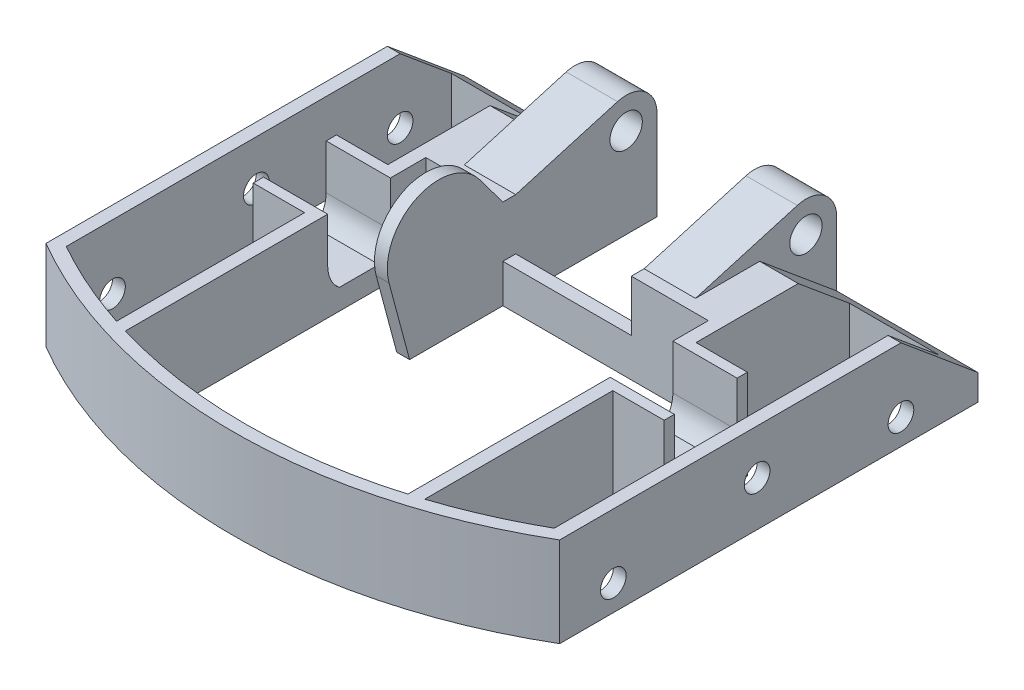
from build123d import *

# Parameters (mm, degrees)
BOSS_EXTRUDE1_DEPTH     = 22.225
CUT_EXTRUDE3_DEPTH      = 155.828053821
CUT_EXTRUDE3_DEPTH_BACK = 155.828053821
BOSS_EXTRUDE3_DEPTH     = 12.7
SKETCH10_W              = 31.75
SKETCH10_H              = 3.175
CUT_EXTRUDE5_DEPTH      = 12.7
CUT_EXTRUDE4_REACH      = 158.104
SKETCH9_R               = 3.175
BOSS_EXTRUDE6_DEPTH     = 3.175
CUT_EXTRUDE8_REACH      = 139.445
BOSS_EXTRUDE7_DEPTH     = 12.7


with BuildPart() as part:
    # Sketch1 → Boss-Extrude1 (new body)
    with BuildSketch(Plane(origin=(0, 0, 0), x_dir=(1, 0, 0), z_dir=(0, 1, 0))):
        with BuildLine():
            Line((-15.875, 0), (-15.875, 34.925))
            Line((-15.875, 34.925), (-63.5, 34.925))
            Line((-63.5, 34.925), (-63.5, -68.511279424))
            ThreePointArc((-63.5, -68.511279424), (0, -85.725), (63.5, -68.511279424))
            Line((63.5, -68.511279424), (63.5, 34.925))
            Line((63.5, 34.925), (15.875, 34.925))
            Line((15.875, 34.925), (15.875, 0))
            Line((15.875, 0), (-15.875, 0))
        make_face()
        with BuildLine():
            ThreePointArc((34.925, -77.468283771), (0, -82.55), (-34.925, -77.468283771))
            Line((-34.925, -77.468283771), (-34.925, -3.175))
            Line((-34.925, -3.175), (34.925, -3.175))
            Line((34.925, -3.175), (34.925, -77.468283771))
        make_face(mode=Mode.SUBTRACT)
        with BuildLine():
            Line((-38.1, 0), (-38.1, -76.477264852))
            ThreePointArc((-38.1, -76.477264852), (-49.455952678, -72.128120752), (-60.325, -66.675))
            Line((-60.325, -66.675), (-60.325, 28.575))
            Line((-60.325, 28.575), (-38.1, 28.575))
            Line((-38.1, 28.575), (-38.1, 0))
        make_face(mode=Mode.SUBTRACT)
        with BuildLine():
            ThreePointArc((60.325, -66.675), (49.455952678, -72.128120752), (38.1, -76.477264852))
            Line((38.1, -76.477264852), (38.1, 0))
            Line((38.1, 0), (38.1, 28.575))
            Line((38.1, 28.575), (60.325, 28.575))
            Line((60.325, 28.575), (60.325, -66.675))
        make_face(mode=Mode.SUBTRACT)
    extrude(amount=BOSS_EXTRUDE1_DEPTH)

    # Sketch3 → Cut-Extrude3 (cut, two sides: drawn at the far end of the back side and taken through both)
    with BuildSketch(Plane.ZY.offset(63.5).offset(-CUT_EXTRUDE3_DEPTH_BACK)):
        Polygon((-229.576794349, -155.859828624), (-34.925, 6.35), (-15.875, 22.225), (178.776794349, 184.434828624), (-145.6428629, 573.738417323), (-553.996451598, 233.443760074), align=None)
    extrude(amount=CUT_EXTRUDE3_DEPTH + CUT_EXTRUDE3_DEPTH_BACK, mode=Mode.SUBTRACT)

    # Sketch7 → Boss-Extrude3 (add)
    with BuildSketch(Plane(origin=(-15.875, 0, 0), x_dir=(0, 0, -1), z_dir=(1, 0, 0))):
        with BuildLine():
            Line((34.925, 0), (34.925, 22.225))
            ThreePointArc((34.925, 22.225), (31.879952535, 28.318784481), (25.178488372, 29.542263716))
            Line((25.178488372, 29.542263716), (0, 22.225))
            Line((0, 22.225), (0, 0))
            Line((0, 0), (34.925, 0))
        make_face()
    boss_extrude3 = extrude(amount=-BOSS_EXTRUDE3_DEPTH)

    # Mirror1: Boss-Extrude3 across plane
    add(boss_extrude3.mirror(Plane(origin=(0, 0, 0), x_dir=(0, 0, 1), z_dir=(1, 0, 0))))

    # Sketch10 → Cut-Extrude5 (cut)
    with BuildSketch(Plane(origin=(0, 22.225, 0), x_dir=(1, 0, 0), z_dir=(0, 1, 0))):
        with Locations((0, -1.5875)):
            Rectangle(SKETCH10_W, SKETCH10_H)
    extrude(amount=-CUT_EXTRUDE5_DEPTH, mode=Mode.SUBTRACT)

    # Sketch8 → Cut-Revolve1 (revolve, cut)
    with BuildSketch(Plane(origin=(0, 26.545081967, -22.120901639), x_dir=(1, 0, 0), z_dir=(0, 0.7682212795973757, -0.6401843996644799))):
        Polygon((28.575, 6.748183757), (-28.575, 6.748183757), (-28.575, 9.748183757), (-26.425, 9.748183757), (-26.425, 10.748183757), (28.575, 10.748183757), align=None)
    revolve(axis=Axis((28.575, 22.225, -27.305), (-1, 0, 0)), mode=Mode.SUBTRACT)

    # Sketch9 → Cut-Extrude4 (cut, up to next)
    with BuildSketch(Plane.ZY.offset(63.5), mode=Mode.PRIVATE) as cut_extrude4_sk1:
        with Locations((-15.875, 6.35)):
            Circle(SKETCH9_R)
    cut_extrude4_tool1 = extrude(cut_extrude4_sk1.sketch, amount=-CUT_EXTRUDE4_REACH, mode=Mode.PRIVATE) & part.part
    # Sketch9 → Cut-Extrude4 (cut, up to next)
    with BuildSketch(Plane.ZY.offset(63.5), mode=Mode.PRIVATE) as cut_extrude4_sk2:
        with Locations((55.245, 6.35)):
            Circle(SKETCH9_R)
    cut_extrude4_tool2 = extrude(cut_extrude4_sk2.sketch, amount=-CUT_EXTRUDE4_REACH, mode=Mode.PRIVATE) & part.part
    # Sketch9 → Cut-Extrude4 (cut, up to next)
    with BuildSketch(Plane.ZY.offset(63.5), mode=Mode.PRIVATE) as cut_extrude4_sk3:
        with Locations((19.685, 11.1125)):
            Circle(SKETCH9_R)
    cut_extrude4_tool3 = extrude(cut_extrude4_sk3.sketch, amount=-CUT_EXTRUDE4_REACH, mode=Mode.PRIVATE) & part.part
    cut_extrude4_1 = cut_extrude4_tool1.solids().sort_by_distance((-63.5, 6.35, -15.875))[0]
    add(cut_extrude4_1, mode=Mode.SUBTRACT)
    cut_extrude4_2 = cut_extrude4_tool2.solids().sort_by_distance((-63.5, 6.35, 55.245))[0]
    add(cut_extrude4_2, mode=Mode.SUBTRACT)
    cut_extrude4_3 = cut_extrude4_tool3.solids().sort_by_distance((-63.5, 11.1125, 19.685))[0]
    add(cut_extrude4_3, mode=Mode.SUBTRACT)
    cut_extrude4 = cut_extrude4_1 + cut_extrude4_2 + cut_extrude4_3  # Cut-Extrude4 as one shape, for the pattern or mirror that repeats it

    # Mirror10: Cut-Extrude4 across plane
    add(cut_extrude4.mirror(Plane(origin=(0, 0, 0), x_dir=(0, 0, 1), z_dir=(1, 0, 0))), mode=Mode.SUBTRACT)

    # Sketch16 → Boss-Extrude6 (add)
    with BuildSketch(Plane(origin=(-15.875, 0, 0), x_dir=(0, 0, -1), z_dir=(1, 0, 0))):
        with BuildLine():
            Line((-8.89, 29.845), (-3.175, 22.225))
            Line((-3.175, 22.225), (0, 22.225))
            Line((0, 22.225), (0, 0))
            Line((0, 0), (-3.175, 0))
            Line((-3.175, 0), (-26.242836689, 0))
            Line((-26.242836689, 0), (-31.317257994, 18.937998127))
            ThreePointArc((-31.317257994, 18.937998127), (-24.604350234, 33.645997919), (-8.89, 29.845))
        make_face()
    extrude(amount=-BOSS_EXTRUDE6_DEPTH)

    # Sketch17 → Cut-Extrude8 (cut, up to next)
    with BuildSketch(Plane.ZY.offset(38.1), mode=Mode.PRIVATE) as cut_extrude8_sk1:
        with BuildLine():
            Line((24.590354218, 5.1125), (14.779645782, 5.1125))
            ThreePointArc((14.779645782, 5.1125), (12.682179312, 7.792409277), (11.935, 11.1125))
            Line((11.935, 11.1125), (11.935, 22.225))
            Line((11.935, 22.225), (27.435, 22.225))
            Line((27.435, 22.225), (27.435, 11.1125))
            ThreePointArc((27.435, 11.1125), (26.687820688, 7.792409277), (24.590354218, 5.1125))
        make_face()
    cut_extrude8_tool1 = extrude(cut_extrude8_sk1.sketch, amount=-CUT_EXTRUDE8_REACH, mode=Mode.PRIVATE) & part.part
    cut_extrude8 = cut_extrude8_tool1.solids().sort_by_distance((-38.1, 13.958781, 19.685))[0]
    add(cut_extrude8, mode=Mode.SUBTRACT)

    # Mirror11: Cut-Extrude8 across plane
    add(cut_extrude8.mirror(Plane(origin=(0, 0, 0), x_dir=(0, 0, 1), z_dir=(1, 0, 0))), mode=Mode.SUBTRACT)

    # Sketch18 → Boss-Extrude7 (add)
    with BuildSketch(Plane(origin=(38.1, 0, 0), x_dir=(0, 0, -1), z_dir=(1, 0, 0))):
        with BuildLine():
            Line((-11.935, 22.225), (-11.935, 11.1125))
            ThreePointArc((-11.935, 11.1125), (-12.682179312, 7.792409277), (-14.779645782, 5.1125))
            Line((-14.779645782, 5.1125), (-24.590354218, 5.1125))
            ThreePointArc((-24.590354218, 5.1125), (-26.687820688, 7.792409277), (-27.435, 11.1125))
            Line((-27.435, 11.1125), (-27.435, 22.225))
            Line((-27.435, 22.225), (-29.975, 22.225))
            Line((-29.975, 22.225), (-29.975, 0))
            Line((-29.975, 0), (-9.395, 0))
            Line((-9.395, 0), (-9.395, 22.225))
            Line((-9.395, 22.225), (-11.935, 22.225))
        make_face()
    boss_extrude7 = extrude(amount=BOSS_EXTRUDE7_DEPTH)

    # Mirror12: Boss-Extrude7 across plane
    add(boss_extrude7.mirror(Plane(origin=(0, 0, 0), x_dir=(0, 0, 1), z_dir=(1, 0, 0))))


solid = part.part
